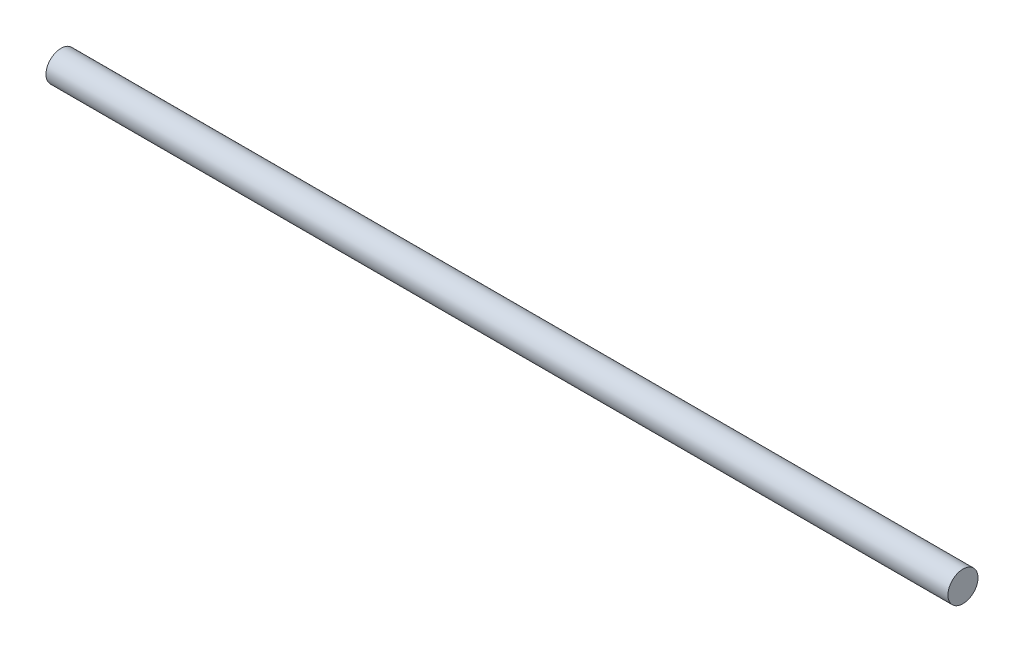
from build123d import *

# Parameters (mm, degrees)
CROQUIS1_R              = 1
SALIENTE_EXTRUIR1_DEPTH = 60


with BuildPart() as part:
    # Croquis1 → Saliente-Extruir1 (new body)
    with BuildSketch(Plane(origin=(0, 0, 0), x_dir=(0, 0, -1), z_dir=(1, 0, 0))):
        Circle(CROQUIS1_R)
    extrude(amount=SALIENTE_EXTRUIR1_DEPTH)


solid = part.part
